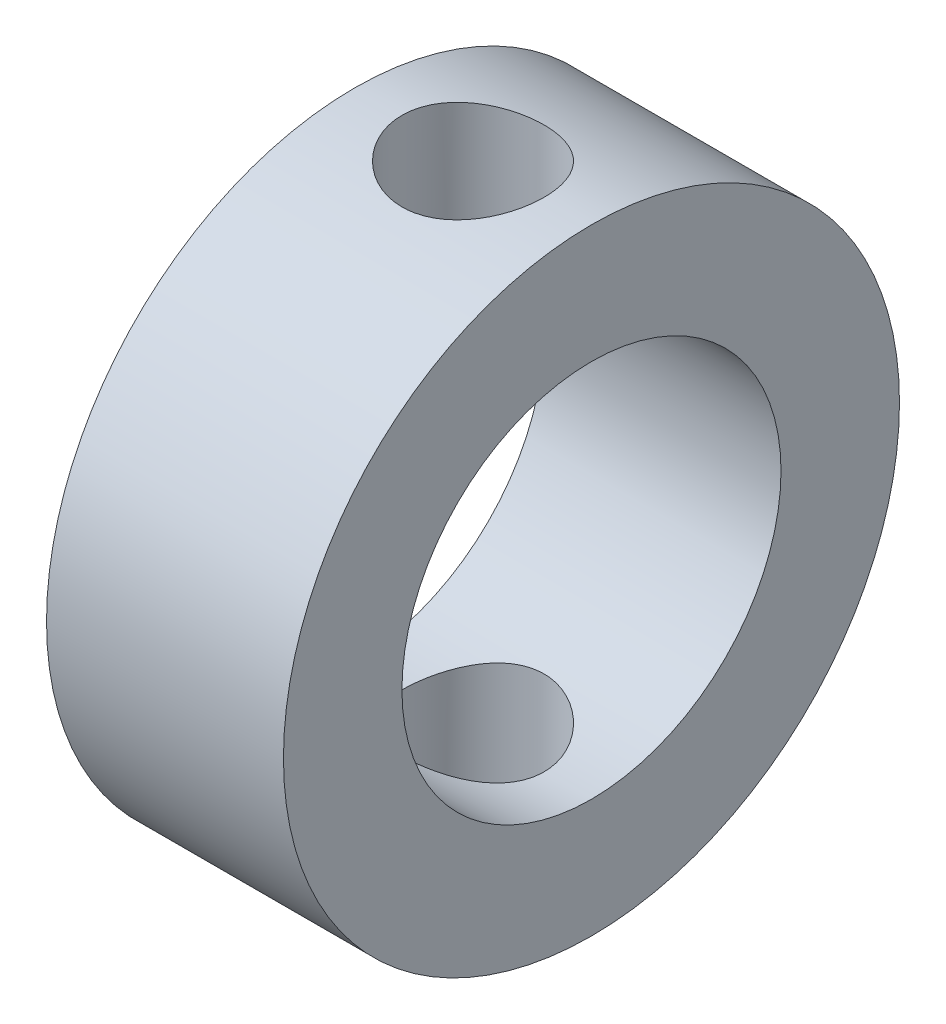
from build123d import *

# Parameters (mm, degrees)
SKETCH1_R               = 13
SKETCH1_R_2             = 8
BOSS_EXTRUDE1_DEPTH     = 5
CUT_EXTRUDE1_DEPTH      = 20.052558883
CUT_EXTRUDE1_DEPTH_BACK = 20.052558883
SKETCH2_R               = 3


with BuildPart() as part:
    # Sketch1 → Boss-Extrude1 (new, symmetric)
    with BuildSketch(Plane.YZ):
        with Locations(Location((0, 0, 0), (0, 0, 270))):
            Circle(SKETCH1_R)
        with Locations(Location((0, 0, 0), (0, 0, 270))):
            Circle(SKETCH1_R_2, mode=Mode.SUBTRACT)
    extrude(amount=BOSS_EXTRUDE1_DEPTH, both=True)

    # Sketch2 → Cut-Extrude1 (cut, two sides: drawn at the far end of the back side and taken through both)
    with BuildSketch(Plane(origin=(0, 0, 0), x_dir=(-1, 0, 0), z_dir=(0, 1, 0)).offset(-CUT_EXTRUDE1_DEPTH_BACK)):
        with Locations(Location((0, 0, 0), (0, 0, 90))):
            Circle(SKETCH2_R)
    extrude(amount=CUT_EXTRUDE1_DEPTH + CUT_EXTRUDE1_DEPTH_BACK, mode=Mode.SUBTRACT)


solid = part.part
